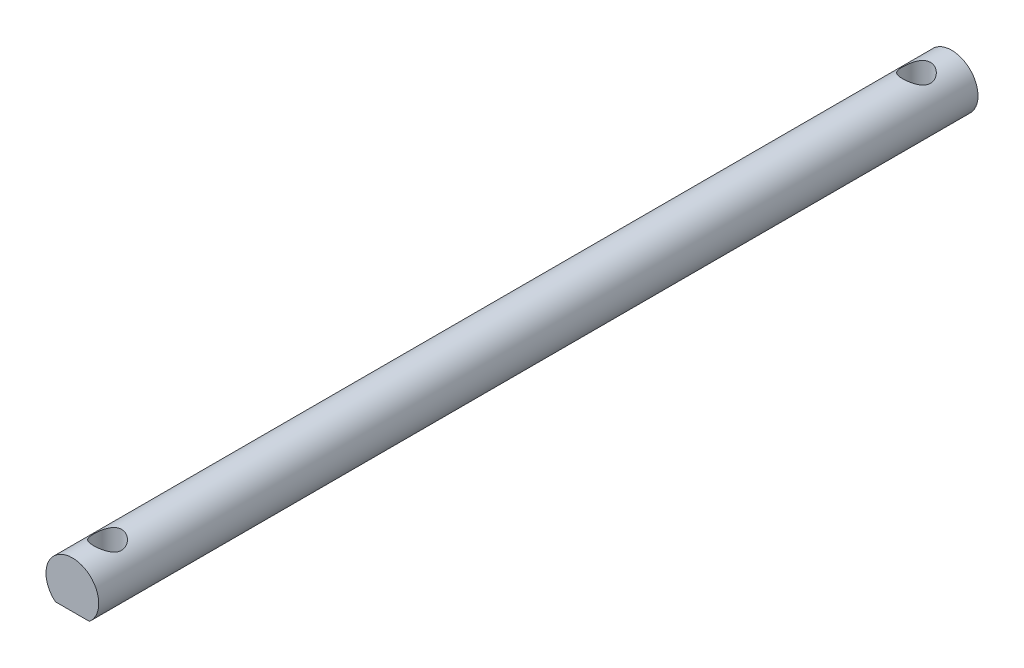
from build123d import *

# Parameters (mm, degrees)
SKETCH1_R               = 1.5
BOSS_EXTRUDE1_DEPTH     = 50
CUT_EXTRUDE1_DEPTH      = 2
CUT_EXTRUDE1_DEPTH_BACK = 50
SKETCH3_W               = 2
SKETCH3_H               = 4.5
CUT_EXTRUDE2_DEPTH      = 50
CUT_EXTRUDE2_DEPTH_BACK = 50
SKETCH4_R               = 0.8


with BuildPart() as part:
    # Sketch1 → Boss-Extrude1 (new body)
    with BuildSketch(Plane.XY):
        with Locations((0, 3.147273027)):
            Circle(SKETCH1_R)
    extrude(amount=BOSS_EXTRUDE1_DEPTH)

    # Sketch3 → Cut-Extrude1 (cut, two sides: drawn at the far end of the back side and taken through both)
    with BuildSketch(Plane(origin=(0, 0, 0), x_dir=(1, 0, 0), z_dir=(0, 1, 0)).offset(-CUT_EXTRUDE1_DEPTH_BACK)):
        with Locations((0, -48.75)):
            Rectangle(SKETCH3_W, SKETCH3_H)
        with Locations((0, -1.25)):
            Rectangle(SKETCH3_W, SKETCH3_H)
    extrude(amount=CUT_EXTRUDE1_DEPTH + CUT_EXTRUDE1_DEPTH_BACK, mode=Mode.SUBTRACT)

    # Sketch4 → Cut-Extrude2 (cut, two sides: drawn at the far end of the back side and taken through both)
    with BuildSketch(Plane(origin=(0, 0, 0), x_dir=(1, 0, 0), z_dir=(0, 1, 0)).offset(-CUT_EXTRUDE2_DEPTH_BACK)):
        with Locations(Location((0, -48, 0), (0, 0, 90))):
            Circle(SKETCH4_R)
        with Locations(Location((0, -2, 0), (0, 0, 90))):
            Circle(SKETCH4_R)
    extrude(amount=CUT_EXTRUDE2_DEPTH + CUT_EXTRUDE2_DEPTH_BACK, mode=Mode.SUBTRACT)


solid = part.part
